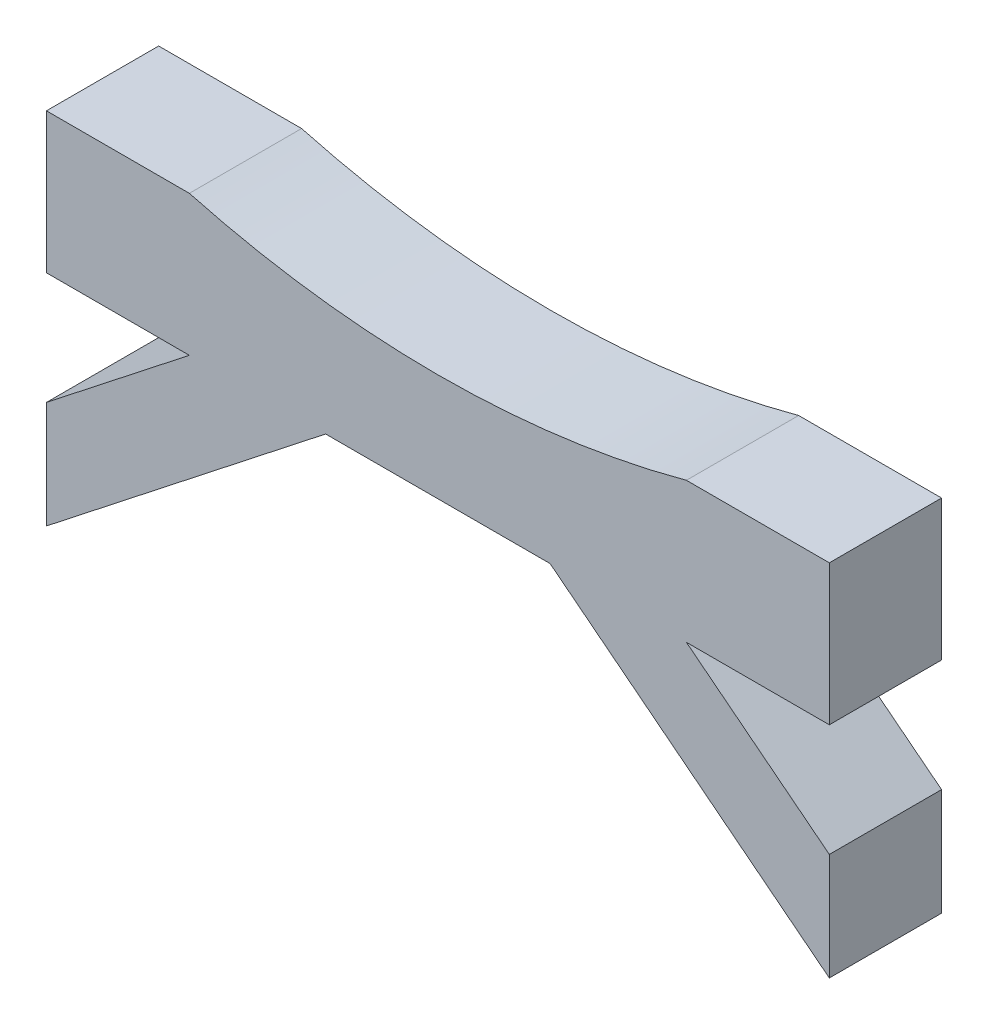
from build123d import *

# Parameters (mm, degrees)
BOSS_EXTRUDE1_DEPTH = 5.08


with BuildPart() as part:
    # Sketch1 → Boss-Extrude1 (new body)
    with BuildSketch(Plane.XY):
        with BuildLine():
            Line((6.468659765, 0), (0, -5.08))
            Line((0, -5.08), (0, -9.924449534))
            Line((0, -9.924449534), (12.637379407, 0))
            Line((12.637379407, 0), (22.797379407, 0))
            Line((22.797379407, 0), (35.434758815, -9.924449534))
            Line((35.434758815, -9.924449534), (35.434758815, -5.08))
            Line((35.434758815, -5.08), (28.96609905, 0))
            Line((28.96609905, 0), (35.434758815, 0))
            Line((35.434758815, 0), (35.434758815, 6.35))
            Line((35.434758815, 6.35), (28.96609905, 6.35))
            ThreePointArc((28.96609905, 6.35), (17.717379407, 4.859071786), (6.468659765, 6.35))
            Line((6.468659765, 6.35), (0, 6.35))
            Line((0, 6.35), (0, 0))
            Line((0, 0), (6.468659765, 0))
        make_face()
    extrude(amount=BOSS_EXTRUDE1_DEPTH)


solid = part.part
